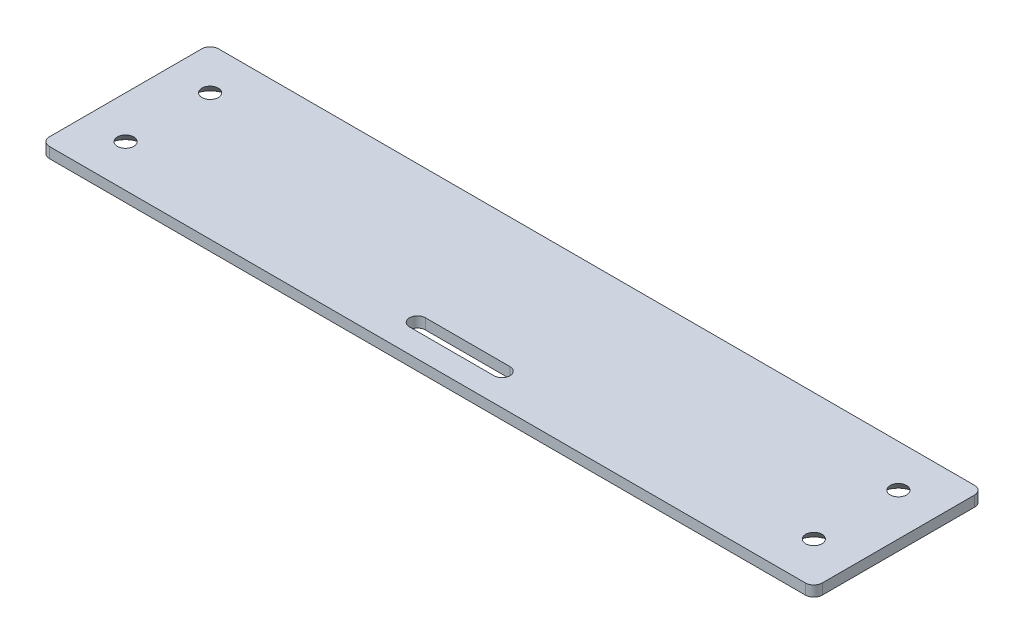
from build123d import *

# Parameters (mm, degrees)
BOSS_EXTRUDE1_DEPTH                   = 3.175
F_10_0_1935_DIAMETER_HOLE1_AT_2_COUNT = 2
F_10_0_1935_DIAMETER_HOLE1_AT_2_PITCH = 25.4
F_10_0_1935_DIAMETER_HOLE1_AT_3_COUNT = 2
F_10_0_1935_DIAMETER_HOLE1_AT_3_PITCH = 208.285436421
F_10_0_1935_DIAMETER_HOLE1_AT_4_COUNT = 2
F_10_0_1935_DIAMETER_HOLE1_AT_4_PITCH = 206.730895187
CUT_EXTRUDE1_DEPTH                    = 3.175


with BuildPart() as part:
    # Sketch1 → Boss-Extrude1 (new body)
    with BuildSketch(Plane(origin=(0, 0, 0), x_dir=(1, 0, 0), z_dir=(0, 1, 0))):
        with BuildLine():
            Line((34.825366444, -125.50484625), (-192.225528743, -125.50484625))
            ThreePointArc((-192.225528743, -125.50484625), (-194.021579967, -126.248795026), (-194.765528743, -128.04484625))
            Line((-194.765528743, -128.04484625), (-194.765528743, -173.76484625))
            ThreePointArc((-194.765528743, -173.76484625), (-194.021579967, -175.560897474), (-192.225528743, -176.30484625))
            Line((-192.225528743, -176.30484625), (34.825366444, -176.30484625))
            ThreePointArc((34.825366444, -176.30484625), (36.621417669, -175.560897474), (37.365366444, -173.76484625))
            Line((37.365366444, -173.76484625), (37.365366444, -128.04484625))
            ThreePointArc((37.365366444, -128.04484625), (36.621417669, -126.248795026), (34.825366444, -125.50484625))
        make_face()
    extrude(amount=BOSS_EXTRUDE1_DEPTH)

    # Sketch4 → #10 (0.1935) Diameter Hole1 (revolve, cut)
    with BuildSketch(Plane(origin=(24.665366444, 0, 163.60484625), x_dir=(0, 0, -1), z_dir=(1, 0, 0))):
        Polygon((0, 0), (0, 3.175), (2.45745, 3.175), (2.45745, 3.177605133), (5.2197, 0), align=None)
    f_10_0_1935_diameter_hole1 = revolve(axis=Axis((24.665366444, -6.35, 163.60484625), (0, 1, 0)), mode=Mode.SUBTRACT)

    # #10 (0.1935) Diameter Hole1 at 2: #10 (0.1935) Diameter Hole1 ×2
    with Locations(*[(0, 0, -i * F_10_0_1935_DIAMETER_HOLE1_AT_2_PITCH) for i in range(1, F_10_0_1935_DIAMETER_HOLE1_AT_2_COUNT)]):
        add(f_10_0_1935_diameter_hole1, mode=Mode.SUBTRACT)

    # #10 (0.1935) Diameter Hole1 at 3: #10 (0.1935) Diameter Hole1 ×2
    with Locations(*[Vector(-0.9925364861794038, 0, -0.12194803648539032) * (i * F_10_0_1935_DIAMETER_HOLE1_AT_3_PITCH) for i in range(1, F_10_0_1935_DIAMETER_HOLE1_AT_3_COUNT)]):
        add(f_10_0_1935_diameter_hole1, mode=Mode.SUBTRACT)

    # #10 (0.1935) Diameter Hole1 at 4: #10 (0.1935) Diameter Hole1 ×2
    with Locations(*[(-i * F_10_0_1935_DIAMETER_HOLE1_AT_4_PITCH, 0, 0) for i in range(1, F_10_0_1935_DIAMETER_HOLE1_AT_4_COUNT)]):
        add(f_10_0_1935_diameter_hole1, mode=Mode.SUBTRACT)

    # Sketch6 → Cut-Extrude1 (cut)
    with BuildSketch(Plane.XZ):
        with BuildLine():
            Line((-65.822128749, 169.16744625), (-91.222128749, 169.16744625))
            ThreePointArc((-91.222128749, 169.16744625), (-93.609728749, 166.77984625), (-91.222128749, 164.39224625))
            Line((-91.222128749, 164.39224625), (-65.822128749, 164.39224625))
            ThreePointArc((-65.822128749, 164.39224625), (-63.434528749, 166.77984625), (-65.822128749, 169.16744625))
        make_face()
    extrude(amount=-CUT_EXTRUDE1_DEPTH, mode=Mode.SUBTRACT)


solid = part.part
